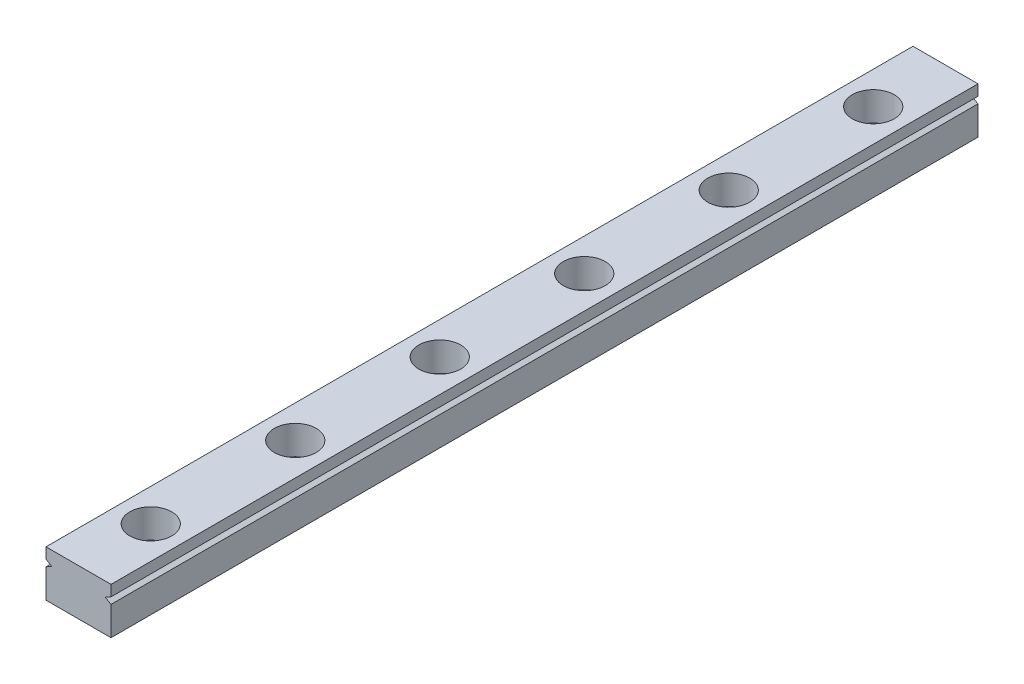
from build123d import *

# Parameters (mm, degrees)
BOSS_EXTRUDE1_DEPTH = 120
SKETCH2_R           = 2.9
CUT_EXTRUDE1_DEPTH  = 4
SKETCH3_R           = 1.7
CUT_EXTRUDE2_DEPTH  = 121.403488322


with BuildPart() as part:
    # Sketch1 → Boss-Extrude1 (new body)
    with BuildSketch(Plane.XY):
        Polygon((9, 6.4), (9, 4.9), (8.2, 4.45), (9, 4), (9, 0), (0, 0), (0, 4), (0.8, 4.45), (0, 4.9), (0, 6.4), align=None)
    extrude(amount=BOSS_EXTRUDE1_DEPTH)

    # Sketch2 → Cut-Extrude1 (cut)
    with BuildSketch(Plane(origin=(0, 6.4, 0), x_dir=(1, 0, 0), z_dir=(0, 1, 0))):
        with Locations(Location((4.5, -110, 0), (0, 0, 270))):
            Circle(SKETCH2_R)
        with Locations(Location((4.5, -90, 0), (0, 0, 270))):
            Circle(SKETCH2_R)
        with Locations(Location((4.5, -70, 0), (0, 0, 270))):
            Circle(SKETCH2_R)
        with Locations(Location((4.5, -50, 0), (0, 0, 270))):
            Circle(SKETCH2_R)
        with Locations(Location((4.5, -30, 0), (0, 0, 270))):
            Circle(SKETCH2_R)
        with Locations(Location((4.5, -10, 0), (0, 0, 270))):
            Circle(SKETCH2_R)
        with Locations((4.5, 10)):
            Circle(SKETCH2_R)
    extrude(amount=-CUT_EXTRUDE1_DEPTH, mode=Mode.SUBTRACT)

    # Sketch3 → Cut-Extrude2 (cut, through all)
    with BuildSketch(Plane(origin=(0, 2.4, 0), x_dir=(1, 0, 0), z_dir=(0, 1, 0))):
        with Locations(Location((4.5, -110, 0), (0, 0, 270))):
            Circle(SKETCH3_R)
        with Locations(Location((4.5, -90, 0), (0, 0, 270))):
            Circle(SKETCH3_R)
        with Locations(Location((4.5, -70, 0), (0, 0, 270))):
            Circle(SKETCH3_R)
        with Locations(Location((4.5, -50, 0), (0, 0, 270))):
            Circle(SKETCH3_R)
        with Locations(Location((4.5, -30, 0), (0, 0, 270))):
            Circle(SKETCH3_R)
        with Locations(Location((4.5, -10, 0), (0, 0, 270))):
            Circle(SKETCH3_R)
        with Locations((4.5, 10)):
            Circle(SKETCH3_R)
    extrude(amount=-CUT_EXTRUDE2_DEPTH, mode=Mode.SUBTRACT)


solid = part.part
